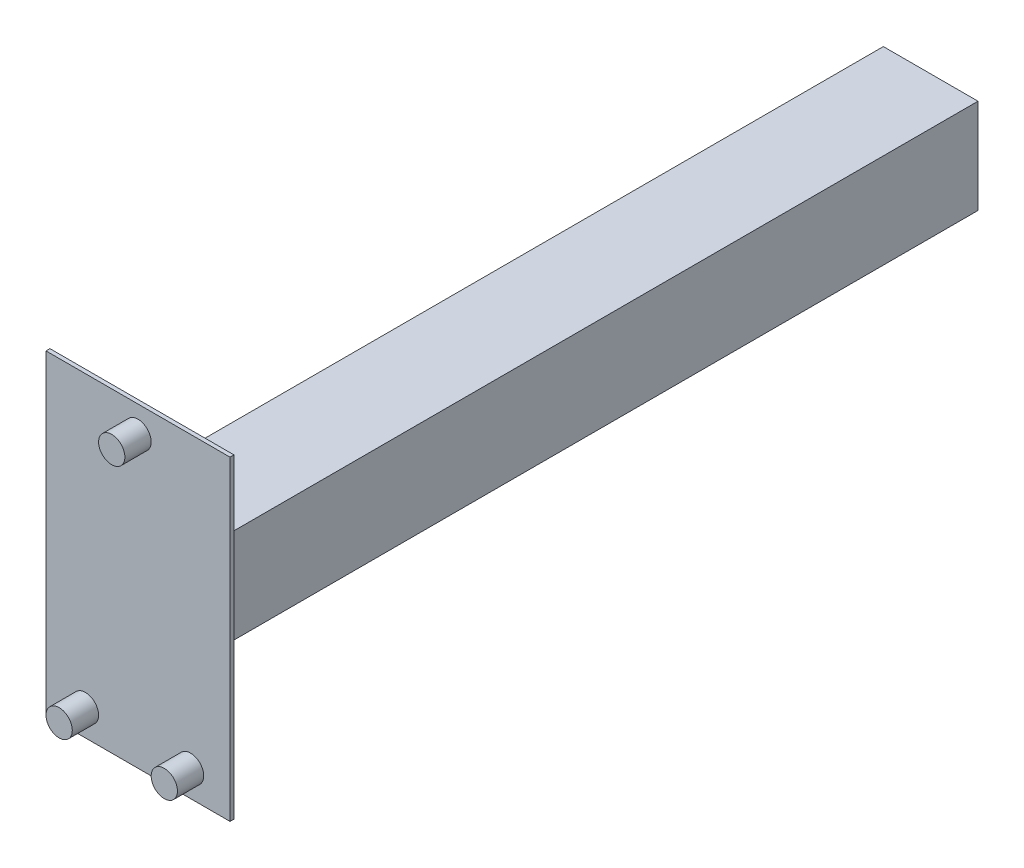
from build123d import *

# Parameters (mm, degrees)
SKETCH1_W           = 36
SKETCH1_H           = 36
BOSS_EXTRUDE1_DEPTH = 300
SKETCH2_W           = 70
SKETCH2_H           = 120
BOSS_EXTRUDE2_DEPTH = 1.5
SKETCH3_R           = 5
BOSS_EXTRUDE3_DEPTH = 10


with BuildPart() as part:
    # Sketch1 → Boss-Extrude1 (new body)
    with BuildSketch(Plane.XY):
        Rectangle(SKETCH1_W, SKETCH1_H)
    extrude(amount=BOSS_EXTRUDE1_DEPTH)

    # Sketch2 → Boss-Extrude2 (add)
    with BuildSketch(Plane.XY.offset(300)):
        Rectangle(SKETCH2_W, SKETCH2_H)
    extrude(amount=BOSS_EXTRUDE2_DEPTH)

    # Sketch3 → Boss-Extrude3 (add)
    with BuildSketch(Plane.XY.offset(301.5)):
        with Locations((0, 50)):
            Circle(SKETCH3_R)
        with Locations((-20, -50)):
            Circle(SKETCH3_R)
        with Locations((20, -50)):
            Circle(SKETCH3_R)
    extrude(amount=BOSS_EXTRUDE3_DEPTH)


solid = part.part
